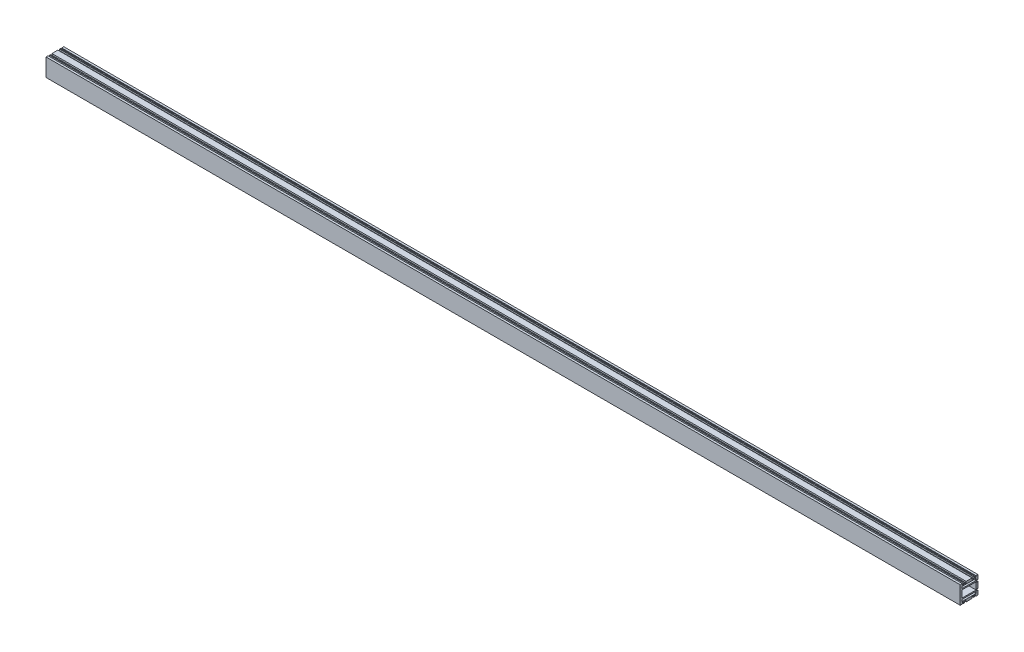
from build123d import *

# Parameters (mm, degrees)
SKETCH_1_W      = 23.5
SKETCH_1_H      = 12
EXTRUDE_1_DEPTH = 771


with BuildPart() as part:
    # 草图1 → 凸台-拉伸1 (new, symmetric)
    with BuildSketch(Plane(origin=(0, 0, 0), x_dir=(0, 0, -1), z_dir=(1, 0, 0))):
        Polygon((-15, 15), (-11.5, 15), (-11.5, 13.5), (-11, 13.5), (-11, 12), (-9.5, 12), (-9.5, 15), (-8, 15), (-8, 12.5), (-5, 12.5), (-5, 15), (5, 15), (5, 12.5), (8, 12.5), (8, 15), (9.5, 15), (9.5, 12), (11, 12), (11, 13.5), (11.5, 13.5), (11.5, 15), (15, 15), (15, 8), (12.5, 8), (12.5, 5), (15, 5), (15, -5), (12.5, -5), (12.5, -8), (15, -8), (15, -15), (11.5, -15), (11.5, -13.5), (11, -13.5), (11, -12), (9.5, -12), (9.5, -15), (8, -15), (8, -12.5), (5, -12.5), (5, -15), (-5, -15), (-5, -12.5), (-8, -12.5), (-8, -15), (-9.5, -15), (-9.5, -12), (-11, -12), (-11, -13.5), (-11.5, -13.5), (-11.5, -15), (-15, -15), align=None)
        with BuildLine():
            Line((12, -10.5), (12, -8.5))
            ThreePointArc((12, -8.5), (11.853553391, -8.146446609), (11.5, -8))
            Line((11.5, -8), (-11.5, -8))
            ThreePointArc((-11.5, -8), (-11.853553391, -8.146446609), (-12, -8.5))
            Line((-12, -8.5), (-12, -10.5))
            ThreePointArc((-12, -10.5), (-11.853553391, -10.853553391), (-11.5, -11))
            Line((-11.5, -11), (11.5, -11))
            ThreePointArc((11.5, -11), (11.853553391, -10.853553391), (12, -10.5))
        make_face(mode=Mode.SUBTRACT)
        with BuildLine():
            Line((-11.5, 11), (11.5, 11))
            ThreePointArc((11.5, 11), (11.853553391, 10.853553391), (12, 10.5))
            Line((12, 10.5), (12, 8.5))
            ThreePointArc((12, 8.5), (11.853553391, 8.146446609), (11.5, 8))
            Line((11.5, 8), (-11.5, 8))
            ThreePointArc((-11.5, 8), (-11.853553391, 8.146446609), (-12, 8.5))
            Line((-12, 8.5), (-12, 10.5))
            ThreePointArc((-12, 10.5), (-11.853553391, 10.853553391), (-11.5, 11))
        make_face(mode=Mode.SUBTRACT)
        Rectangle(SKETCH_1_W, SKETCH_1_H, mode=Mode.SUBTRACT)
    extrude(amount=EXTRUDE_1_DEPTH, both=True)


solid = part.part
